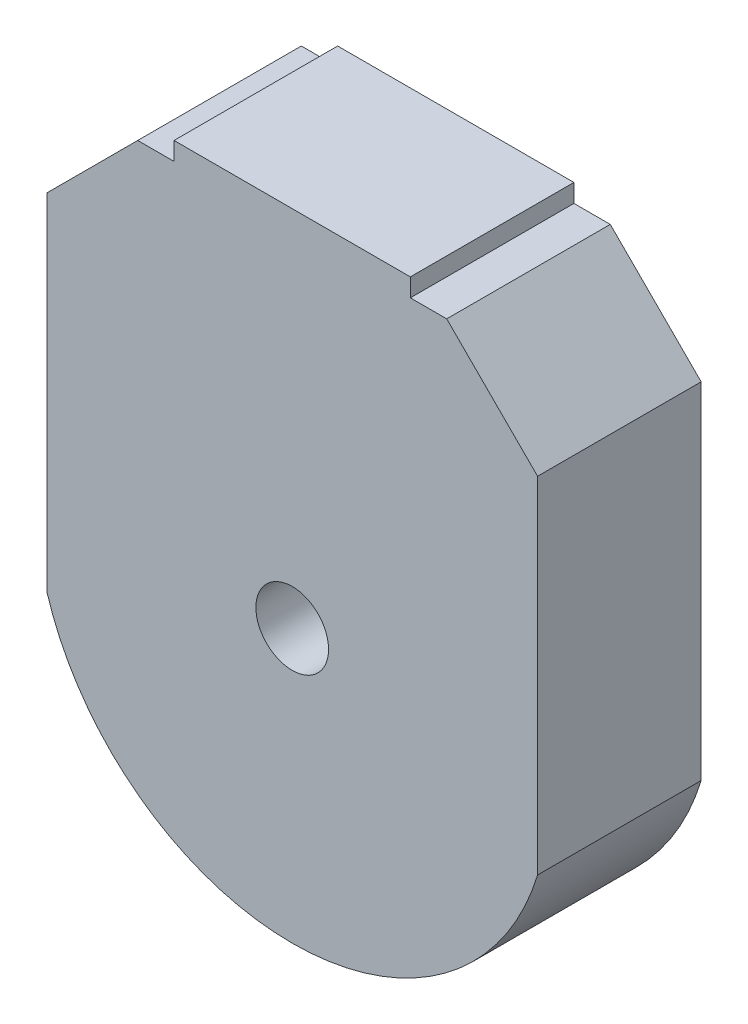
from build123d import *

# Parameters (mm, degrees)
ESQUISSE1_R        = 2
BOSS_EXTRU_2_DEPTH = 9


with BuildPart() as part:
    # Esquisse1 → Boss.-Extru.2 (new body)
    with BuildSketch(Plane.XY):
        with BuildLine():
            Line((6.5, 35), (-6.5, 35))
            Line((-6.5, 35), (-6.5, 34))
            Line((-6.5, 34), (-8.5, 34))
            Line((-8.5, 34), (-13.5, 29))
            Line((-13.5, 29), (-13.5, 10))
            ThreePointArc((-13.5, 10), (0, 0), (13.5, 10))
            Line((13.5, 10), (13.5, 29))
            Line((13.5, 29), (8.5, 34))
            Line((8.5, 34), (6.5, 34))
            Line((6.5, 34), (6.5, 35))
        make_face()
        with Locations((0, 15)):
            Circle(ESQUISSE1_R, mode=Mode.SUBTRACT)
    extrude(amount=BOSS_EXTRU_2_DEPTH)


solid = part.part
